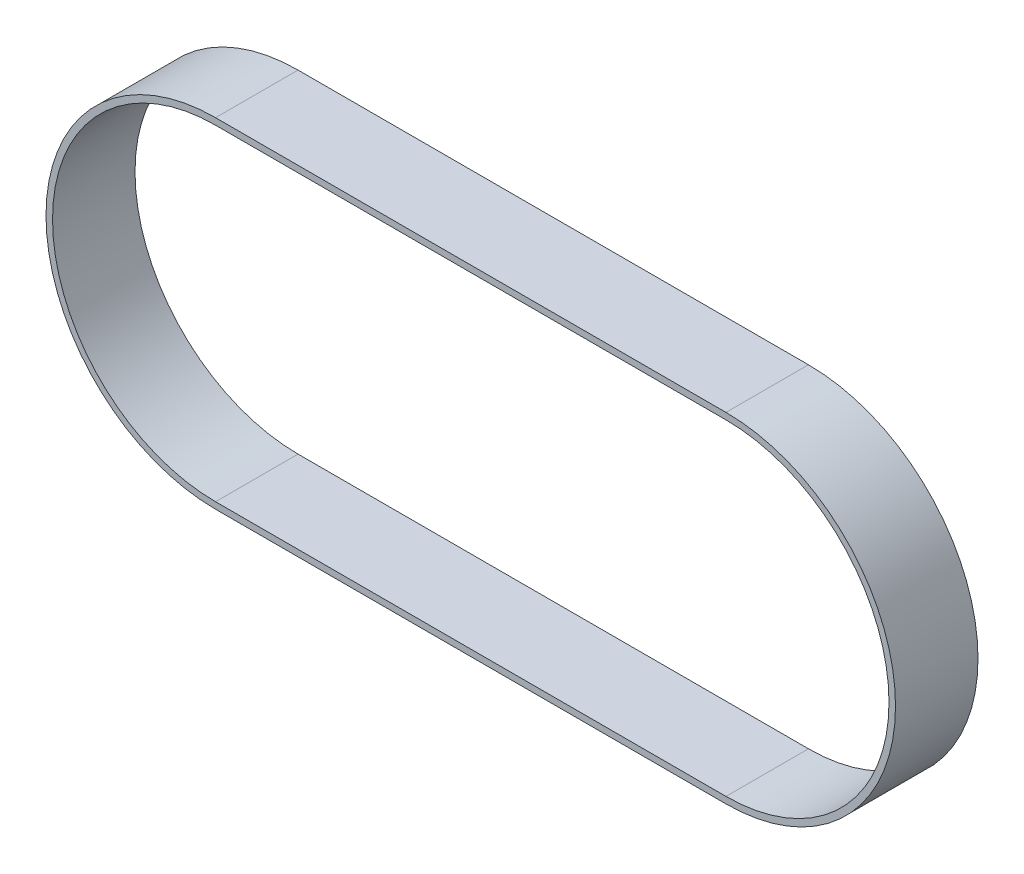
from build123d import *

# Parameters (mm, degrees)
BOSS_EXTRUDE1_DEPTH = 12.65


with BuildPart() as part:
    # Sketch2 → Boss-Extrude1 (new, symmetric)
    with BuildSketch(Plane.XY):
        with BuildLine():
            Line((-168.807812834, 52), (-12.267812834, 52))
            ThreePointArc((-12.267812834, 52), (39.732187166, 0), (-12.267812834, -52))
            Line((-12.267812834, -52), (-168.807812834, -52))
            ThreePointArc((-168.807812834, -52), (-220.807812834, 0), (-168.807812834, 52))
        make_face()
        with BuildLine():
            Line((-168.807812834, 50), (-12.267812834, 50))
            ThreePointArc((-12.267812834, 50), (37.732187166, 0), (-12.267812834, -50))
            Line((-12.267812834, -50), (-168.807812834, -50))
            ThreePointArc((-168.807812834, -50), (-218.807812834, 0), (-168.807812834, 50))
        make_face(mode=Mode.SUBTRACT)
    extrude(amount=BOSS_EXTRUDE1_DEPTH, both=True)


solid = part.part
